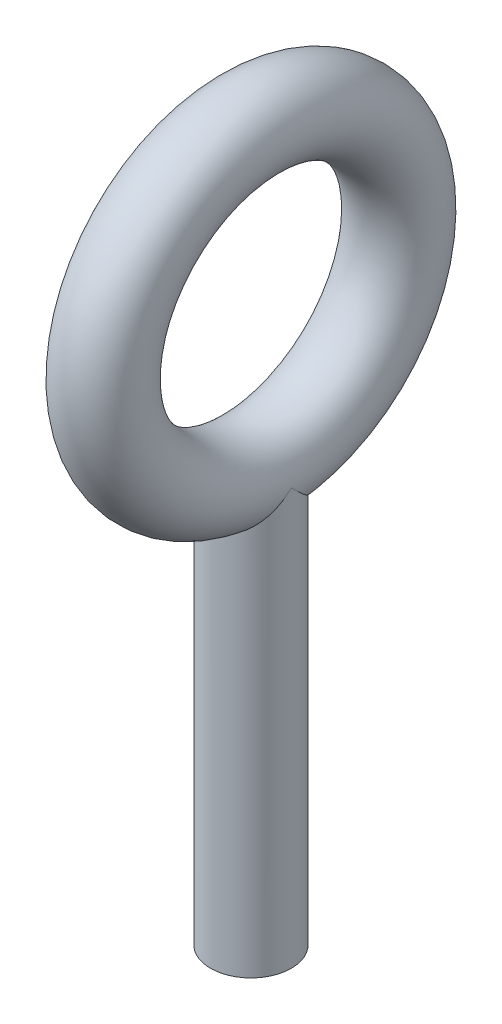
from build123d import *

# Parameters (mm, degrees)
SKETCH1_R = 0.5969


with BuildPart() as part:
    # Sketch1 → Revolve5 (revolve)
    with BuildSketch(Plane.XY):
        Circle(SKETCH1_R)
    revolve(axis=Axis((0, 2.1844, 0), (1, 0, 0)))

    # Sketch1<9> → Revolve6 (revolve)
    with BuildSketch(Plane.XY):
        with BuildLine():
            Line((0.5969, -6.1468), (0.5969, 0))
            ThreePointArc((0.5969, 0), (0.422072038, -0.422072038), (0, -0.5969))
            Line((0, -0.5969), (0, -6.1468))
            Line((0, -6.1468), (0.5969, -6.1468))
        make_face()
    revolve(axis=Axis((0, 0, 0), (0, -1, 0)))


solid = part.part
